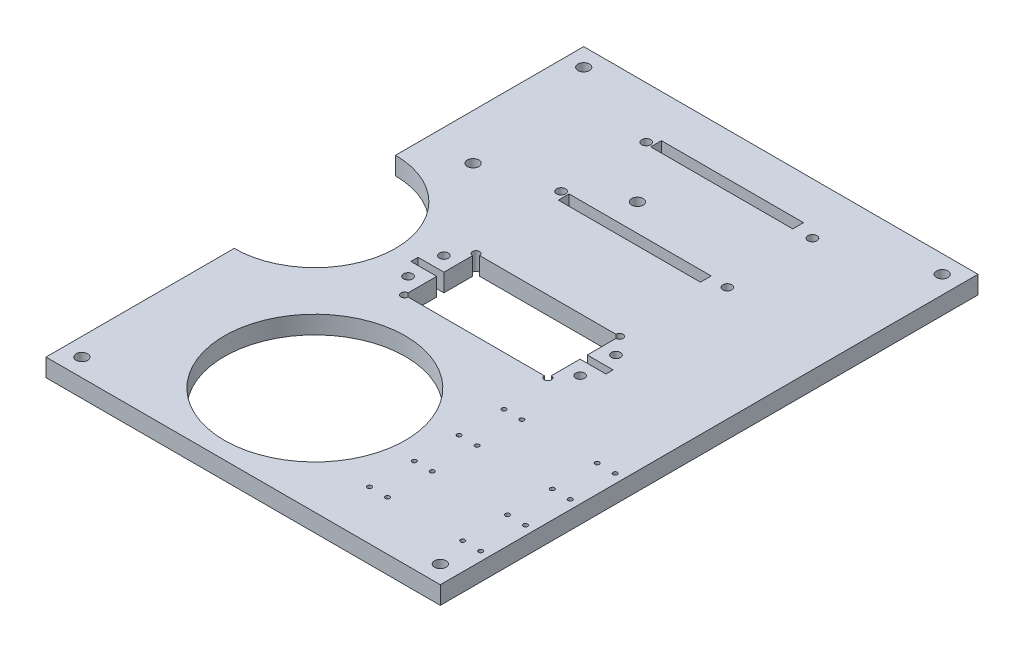
from build123d import *

# Parameters (mm, degrees)
SKETCH_1_R         = 0.6
SKETCH_1_R_2       = 1.6
SKETCH_1_W         = 39.63
SKETCH_1_H         = 3
EXTRUDE_1_DEPTH    = 5
HOLE_WIZARD_M3_1_D = 2.5


with BuildPart() as part:
    # 草圖1 → 填料-伸長1 (new body)
    with BuildSketch(Plane(origin=(0, 0, 0), x_dir=(1, 0, 0), z_dir=(0, 1, 0))):
        with BuildLine():
            Line((110, 75), (0, 75))
            Line((0, 75), (0, 22.5))
            ThreePointArc((0, 22.5), (22.5, 0), (0, -22.5))
            Line((0, -22.5), (0, -75))
            Line((0, -75), (46, -75))
            Line((46, -75), (110, -75))
            Line((110, -75), (110, 75))
        make_face()
        with Locations(Location((76.5, -61.25, 0), (0, 0, 270))):
            Circle(SKETCH_1_R, mode=Mode.SUBTRACT)
        with Locations(Location((5, 70, 0), (0, 0, 270))):
            Circle(SKETCH_1_R_2, mode=Mode.SUBTRACT)
        with Locations(Location((5, -70, 0), (0, 0, 270))):
            Circle(SKETCH_1_R_2, mode=Mode.SUBTRACT)
        with Locations(Location((105, -70, 0), (0, 0, 270))):
            Circle(SKETCH_1_R_2, mode=Mode.SUBTRACT)
        with Locations(Location((105, 70, 0), (0, 0, 270))):
            Circle(SKETCH_1_R_2, mode=Mode.SUBTRACT)
        with Locations(Location((107.5, -61.25, 0), (0, 0, 270))):
            Circle(SKETCH_1_R, mode=Mode.SUBTRACT)
        with Locations(Location((107.5, -48.75, 0), (0, 0, 270))):
            Circle(SKETCH_1_R, mode=Mode.SUBTRACT)
        with Locations(Location((102.5, -48.75, 0), (0, 0, 270))):
            Circle(SKETCH_1_R, mode=Mode.SUBTRACT)
        with Locations(Location((107.5, -23.75, 0), (0, 0, 270))):
            Circle(SKETCH_1_R, mode=Mode.SUBTRACT)
        with Locations(Location((102.5, -36.25, 0), (0, 0, 270))):
            Circle(SKETCH_1_R, mode=Mode.SUBTRACT)
        with Locations(Location((81.5, -48.75, 0), (0, 0, 270))):
            Circle(SKETCH_1_R, mode=Mode.SUBTRACT)
        with Locations(Location((102.5, -23.75, 0), (0, 0, 270))):
            Circle(SKETCH_1_R, mode=Mode.SUBTRACT)
        with Locations(Location((107.5, -36.25, 0), (0, 0, 270))):
            Circle(SKETCH_1_R, mode=Mode.SUBTRACT)
        with Locations(Location((102.5, -61.25, 0), (0, 0, 270))):
            Circle(SKETCH_1_R, mode=Mode.SUBTRACT)
        with Locations(Location((81.5, -36.25, 0), (0, 0, 270))):
            Circle(SKETCH_1_R, mode=Mode.SUBTRACT)
        with Locations(Location((76.5, -48.75, 0), (0, 0, 270))):
            Circle(SKETCH_1_R, mode=Mode.SUBTRACT)
        with Locations(Location((81.5, -61.25, 0), (0, 0, 270))):
            Circle(SKETCH_1_R, mode=Mode.SUBTRACT)
        with Locations(Location((81.5, -23.75, 0), (0, 0, 270))):
            Circle(SKETCH_1_R, mode=Mode.SUBTRACT)
        with Locations(Location((76.5, -36.25, 0), (0, 0, 270))):
            Circle(SKETCH_1_R, mode=Mode.SUBTRACT)
        with Locations(Location((76.5, -23.75, 0), (0, 0, 270))):
            Circle(SKETCH_1_R, mode=Mode.SUBTRACT)
        with Locations(Location((45, 45, 0), (0, 0, 270))):
            Circle(SKETCH_1_R_2, mode=Mode.SUBTRACT)
        with Locations(Location((12.75503676, 31.388888889, 0), (0, 0, 270))):
            Circle(SKETCH_1_R_2, mode=Mode.SUBTRACT)
        with BuildLine():
            Line((75, -9), (75, -1))
            Line((75, -1), (82.2, -1))
            Line((82.2, -1), (82.2, 1))
            Line((82.2, 1), (75, 1))
            Line((75, 1), (75, 9))
            ThreePointArc((75, 9), (75.707106781, 10.707106781), (74, 10))
            Line((74, 10), (36, 10))
            ThreePointArc((36, 10), (34.292893219, 10.707106781), (35, 9))
            Line((35, 9), (35, 1))
            Line((35, 1), (27.8, 1))
            Line((27.8, 1), (27.8, -1))
            Line((27.8, -1), (35, -1))
            Line((35, -1), (35, -9))
            ThreePointArc((35, -9), (34.292893219, -10.707106781), (36, -10))
            Line((36, -10), (74, -10))
            ThreePointArc((74, -10), (75.707106781, -10.707106781), (75, -9))
        make_face(mode=Mode.SUBTRACT)
        with Locations((53.375, 61.625)):
            Rectangle(SKETCH_1_W, SKETCH_1_H, mode=Mode.SUBTRACT)
        with Locations((53.375, 35.875)):
            Rectangle(SKETCH_1_W, SKETCH_1_H, mode=Mode.SUBTRACT)
        with BuildLine():
            ThreePointArc((46, -70.230190249), (70.25, -45), (46, -19.769809751))
            ThreePointArc((46, -19.769809751), (19.75, -45), (46, -70.230190249))
        make_face(mode=Mode.SUBTRACT)
    extrude(amount=-EXTRUDE_1_DEPTH)

    # M3 螺紋孔1 (through all)
    with Locations(Plane(origin=(0, 0, 0), x_dir=(1, 0, 0), z_dir=(0, 1, 0))):
        with Locations((31, 5), (31, -5), (79, -5), (79, 5), (31.81, 36.875), (31.81, 60.625), (78.19, 60.625), (78.19, 36.875)):
            Hole(HOLE_WIZARD_M3_1_D / 2)


solid = part.part
